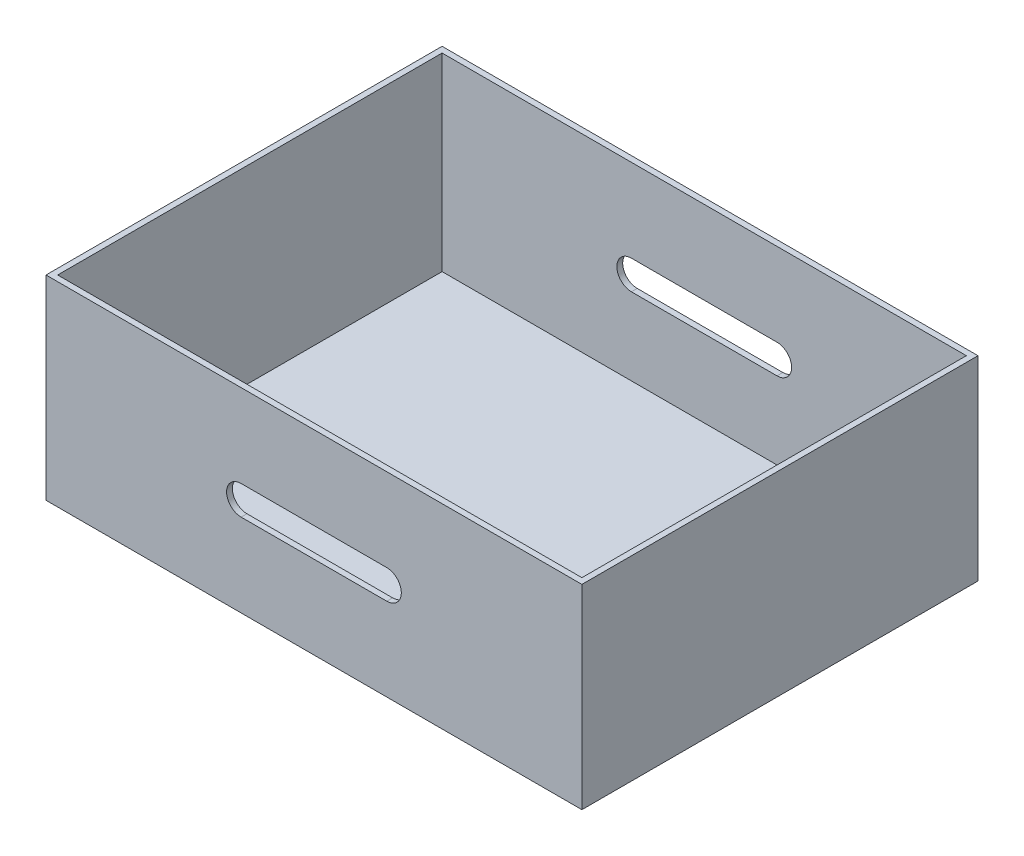
from build123d import *

# Parameters (mm, degrees)
ESBO_O1_W                = 184
ESBO_O1_H                = 136
RESSALTO_EXTRUS_O1_DEPTH = 2
ESBO_O2_W                = 184
ESBO_O2_H                = 136
ESBO_O2_W_2              = 180
ESBO_O2_H_2              = 132
EXTRUS_O_FINA1_DEPTH     = 65
CORTE_EXTRUS_O1_DEPTH    = 178.338659068


with BuildPart() as part:
    # Esboço1 → Ressalto-extrusão1 (new body)
    with BuildSketch(Plane(origin=(0, 0, 0), x_dir=(1, 0, 0), z_dir=(0, 1, 0))):
        Rectangle(ESBO_O1_W, ESBO_O1_H)
    extrude(amount=RESSALTO_EXTRUS_O1_DEPTH)

    # Esboço2 → Extrusão-Fina1 (add)
    with BuildSketch(Plane(origin=(0, 2, 0), x_dir=(1, 0, 0), z_dir=(0, 1, 0))):
        Rectangle(ESBO_O2_W, ESBO_O2_H)
        Rectangle(ESBO_O2_W_2, ESBO_O2_H_2, mode=Mode.SUBTRACT)
    extrude(amount=EXTRUS_O_FINA1_DEPTH)

    # Esboço3 → Corte-extrusão1 (cut, through all)
    with BuildSketch(Plane.XY.offset(68)):
        with BuildLine():
            Line((-25, 38.5), (25, 38.5))
            ThreePointArc((25, 38.5), (30, 33.5), (25, 28.5))
            Line((25, 28.5), (-25, 28.5))
            ThreePointArc((-25, 28.5), (-30, 33.5), (-25, 38.5))
        make_face()
    extrude(amount=-CORTE_EXTRUS_O1_DEPTH, mode=Mode.SUBTRACT)


solid = part.part
